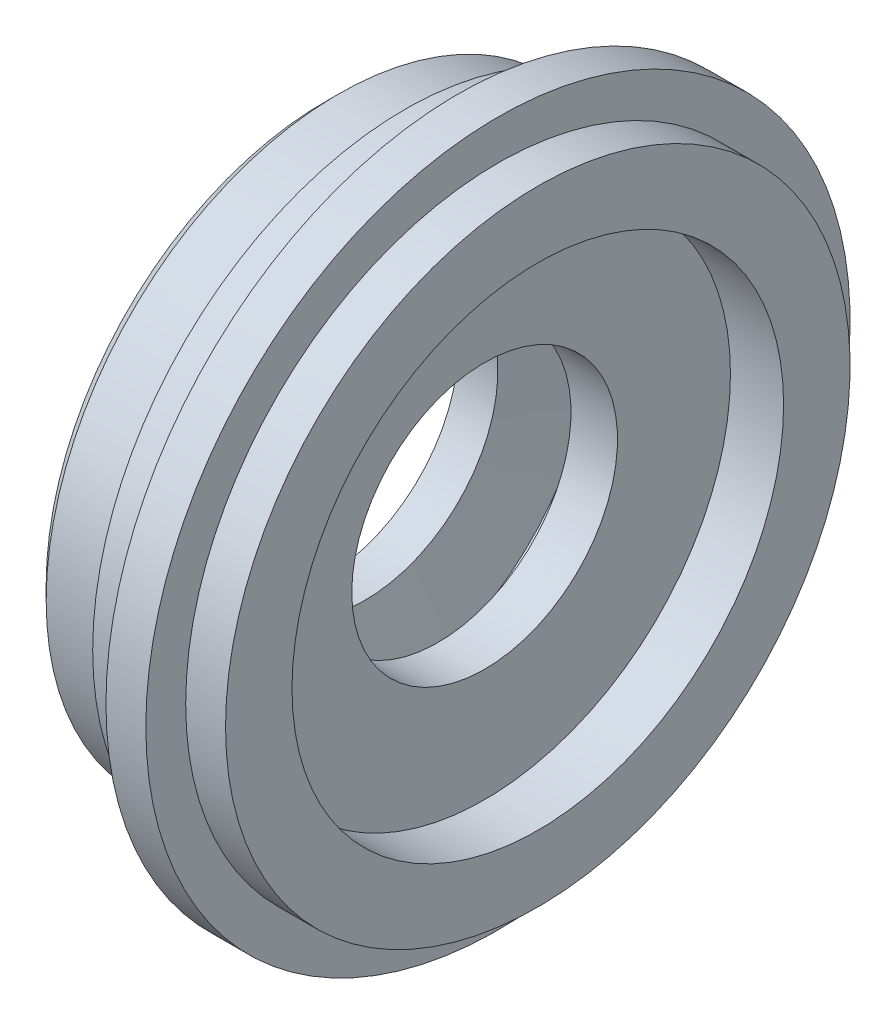
from build123d import *


with BuildPart() as part:
    # 草图1 → 旋转1 (revolve)
    with BuildSketch(Plane.XY, mode=Mode.PRIVATE) as revolve_1_sk:
        Polygon((0, 21), (1, 22), (6, 22), (6, 23.5), (10, 23.5), (10, 26.5), (13, 26.5), (13, 23.5), (16, 23.5), (16, 18.5), (12, 18.5), (12, 10), (8.5, 10), (7.75, 16.5), (3.75, 16.5), (3, 10), (0, 10), align=None)
    revolve(revolve_1_sk.sketch.rotate(Axis((0, 0, 0), (1, 0, 0)), 90), axis=Axis((0, 0, 0), (1, 0, 0)))


solid = part.part
